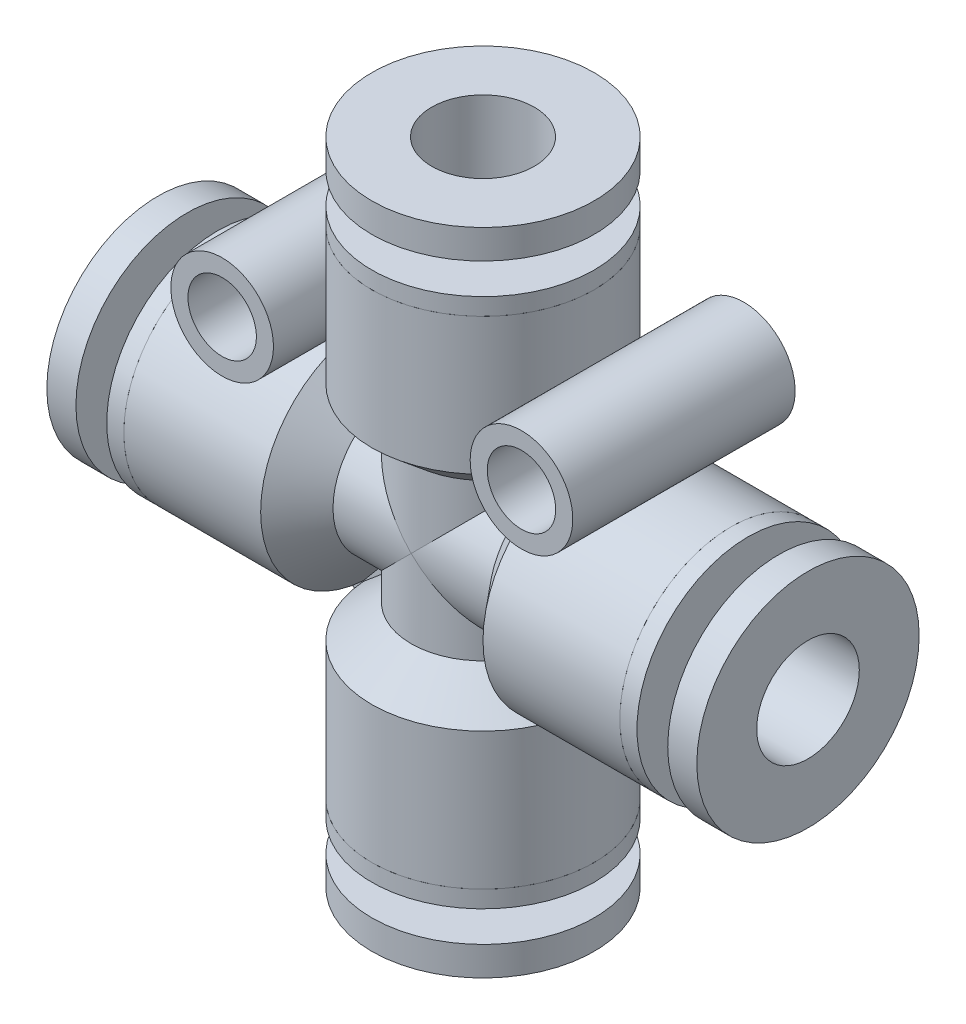
from build123d import *

# Parameters (mm, degrees)
ENL_V_MAT_EXTRU_1_DEPTH      = 18.168284713
BOSS_EXTRU_1_DEPTH           = 0.5
ESQUISSE4_R                  = 3
ESQUISSE4_R_2                = 2
BOSS_EXTRU_2_DEPTH           = 6.5
ESQUISSE7_R                  = 6.5
ESQUISSE7_R_2                = 3.5
BOSS_EXTRU_4_DEPTH           = 1
R_P_TITION_CIRCULAIRE3_COUNT = 4


with BuildPart() as part:
    # Esquisse1 → Révolution1 (revolve)
    with BuildSketch(Plane.XY):
        Polygon((-4.2, 4.570070848), (-4.2, 0), (-1.5, 0), (-1.5, 3.5), (-3, 3.5), (-3, 14.5), (-6.5, 14.5), (-6.5, 6.5), align=None)
    revolve(axis=Axis((0, 0, 0), (0, 1, 0)))

    # Esquisse2 → Enlèv. mat.-Extru.1 (cut, symmetric)
    with BuildSketch(Plane.XY):
        Polygon((0, 0), (-6.5, 0), (-6.5, 6.5), align=None)
    enl_v_mat_extru_1 = extrude(amount=ENL_V_MAT_EXTRU_1_DEPTH, both=True, mode=Mode.SUBTRACT)

    # Symétrie1: Enlèv. mat.-Extru.1 across plane
    add(enl_v_mat_extru_1.mirror(Plane(origin=(0, 0, 0), x_dir=(0, 0, 1), z_dir=(1, 0, 0))), mode=Mode.SUBTRACT)

    # Esquisse3 → Boss.-Extru.1 (add, symmetric)
    with BuildSketch(Plane.XY):
        Polygon((-3, 3), (-7.071067812, 7.071067812), (-4, 10.142135624), (-3, 10.142135624), align=None)
        Polygon((3, 3), (7.071067812, 7.071067812), (4, 10.142135624), (3, 10.142135624), align=None)
    extrude(amount=BOSS_EXTRU_1_DEPTH, both=True)

    # Symétrie2: part across plane


with BuildPart() as part_1:
    add(part.part)
    add(part.part.mirror(Plane(origin=(-6.5, 6.5, -6.5), x_dir=(0, 0, 1), z_dir=(0.7071067811865476, 0.7071067811865476, 0))))

    # Symétrie3: part across plane


with BuildPart() as part_2:
    add(part_1.part)
    add(part_1.part.mirror(Plane(origin=(6.5, 6.5, -6.5), x_dir=(0, 0, 1), z_dir=(0.7071067811865476, -0.7071067811865476, 0))))

    # Esquisse4 → Boss.-Extru.2 (add, symmetric)
    # profile 1 of 2: a face of its own
    with BuildSketch(Plane.XY):
        with Locations((-8.75, 8.75)):
            Circle(ESQUISSE4_R)
        with Locations((-8.75, 8.75)):
            Circle(ESQUISSE4_R_2, mode=Mode.SUBTRACT)
    # profile 2 of 2: a face of its own
    with BuildSketch(Plane.XY):
        with Locations((8.75, 8.75)):
            Circle(ESQUISSE4_R)
        with Locations((8.75, 8.75)):
            Circle(ESQUISSE4_R_2, mode=Mode.SUBTRACT)
    extrude(amount=BOSS_EXTRU_2_DEPTH, both=True)


with BuildPart() as body_2:
    # Esquisse6 → Révolution2 (revolve)
    with BuildSketch(Plane.XY):
        Polygon((-6.5, 19), (-3, 19), (-3, 14.5), (-3.5, 14.5), (-3.5, 17.3), (-6.5, 17.3), align=None)
    revolve(axis=Axis((0, 0, 0), (0, 1, 0)))


with BuildPart() as body_3:
    # Esquisse7 → Boss.-Extru.4 (new body)
    with BuildSketch(Plane(origin=(0, 14.5, 0), x_dir=(1, 0, 0), z_dir=(0, 1, 0))):
        Circle(ESQUISSE7_R)
        Circle(ESQUISSE7_R_2, mode=Mode.SUBTRACT)
    extrude(amount=BOSS_EXTRU_4_DEPTH)


with BuildPart() as r_p_tition_circulaire3_1:
    # Répétition circulaire3: pattern copy
    add(body_2.part.rotate(Axis((0, 0, -80.9), (0, 0, 1)), 1 * 360 / R_P_TITION_CIRCULAIRE3_COUNT))


with BuildPart() as r_p_tition_circulaire3_2:
    # Répétition circulaire3: pattern copy
    add(body_2.part.rotate(Axis((0, 0, -80.9), (0, 0, 1)), 2 * 360 / R_P_TITION_CIRCULAIRE3_COUNT))


with BuildPart() as r_p_tition_circulaire3_3:
    # Répétition circulaire3: pattern copy
    add(body_2.part.rotate(Axis((0, 0, -80.9), (0, 0, 1)), 3 * 360 / R_P_TITION_CIRCULAIRE3_COUNT))


with BuildPart() as r_p_tition_circulaire3_4:
    # Répétition circulaire3: pattern copy
    add(body_3.part.rotate(Axis((0, 0, -80.9), (0, 0, 1)), 1 * 360 / R_P_TITION_CIRCULAIRE3_COUNT))


with BuildPart() as r_p_tition_circulaire3_5:
    # Répétition circulaire3: pattern copy
    add(body_3.part.rotate(Axis((0, 0, -80.9), (0, 0, 1)), 2 * 360 / R_P_TITION_CIRCULAIRE3_COUNT))


with BuildPart() as r_p_tition_circulaire3_6:
    # Répétition circulaire3: pattern copy
    add(body_3.part.rotate(Axis((0, 0, -80.9), (0, 0, 1)), 3 * 360 / R_P_TITION_CIRCULAIRE3_COUNT))


solid = Compound([part_2.part, body_2.part, body_3.part, r_p_tition_circulaire3_1.part, r_p_tition_circulaire3_2.part, r_p_tition_circulaire3_3.part, r_p_tition_circulaire3_4.part, r_p_tition_circulaire3_5.part, r_p_tition_circulaire3_6.part])
